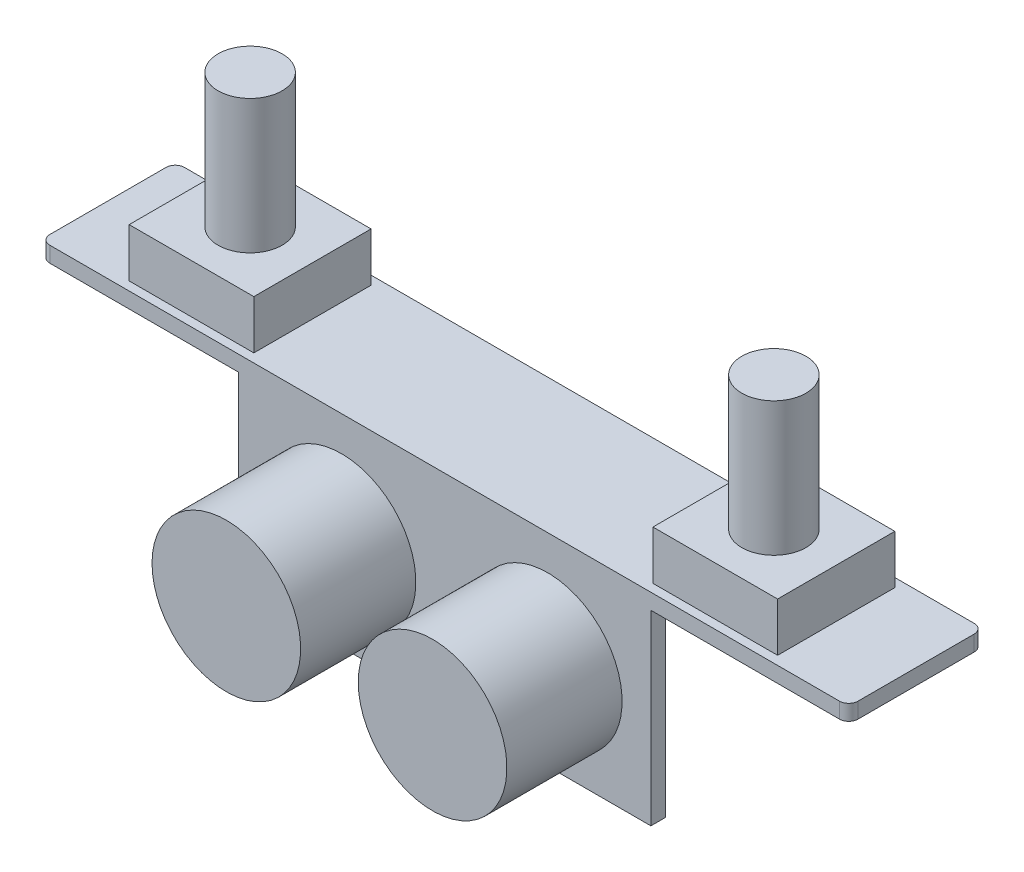
from build123d import *

# Parameters (mm, degrees)
BOSS_EXTRUDE1_DEPTH = 1.68
SKETCH3_W           = 13.42
SKETCH3_H           = 12.62
BOSS_EXTRUDE2_DEPTH = 5.25
SKETCH4_R           = 3.45
BOSS_EXTRUDE3_DEPTH = 14.4
SKETCH5_W           = 44.4
SKETCH5_H           = 20.1
BOSS_EXTRUDE4_DEPTH = 1.6
SKETCH6_R           = 8
BOSS_EXTRUDE5_DEPTH = 12.4


with BuildPart() as part:
    # Sketch1 → Boss-Extrude1 (new body)
    with BuildSketch(Plane(origin=(0, 0, 0), x_dir=(1, 0, 0), z_dir=(0, 1, 0))):
        with BuildLine():
            Line((-42.5, 7.25), (42.5, 7.25))
            ThreePointArc((42.5, 7.25), (43.207106781, 6.957106781), (43.5, 6.25))
            Line((43.5, 6.25), (43.5, -6.25))
            ThreePointArc((43.5, -6.25), (43.207106781, -6.957106781), (42.5, -7.25))
            Line((42.5, -7.25), (-42.5, -7.25))
            ThreePointArc((-42.5, -7.25), (-43.207106781, -6.957106781), (-43.5, -6.25))
            Line((-43.5, -6.25), (-43.5, 6.25))
            ThreePointArc((-43.5, 6.25), (-43.207106781, 6.957106781), (-42.5, 7.25))
        make_face()
    extrude(amount=BOSS_EXTRUDE1_DEPTH)

    # Sketch3 → Boss-Extrude2 (add)
    with BuildSketch(Plane(origin=(0, 1.68, 0), x_dir=(1, 0, 0), z_dir=(0, 1, 0))):
        with Locations((28.19, 0)):
            Rectangle(SKETCH3_W, SKETCH3_H)
        with Locations((-28.19, 0)):
            Rectangle(SKETCH3_W, SKETCH3_H)
    extrude(amount=BOSS_EXTRUDE2_DEPTH)

    # Sketch4 → Boss-Extrude3 (add)
    with BuildSketch(Plane(origin=(0, 6.93, 0), x_dir=(1, 0, 0), z_dir=(0, 1, 0))):
        with Locations(Location((-28.19, 0, 0), (0, 0, 270))):
            Circle(SKETCH4_R)
        with Locations(Location((28.19, 0, 0), (0, 0, 90))):
            Circle(SKETCH4_R)
    extrude(amount=BOSS_EXTRUDE3_DEPTH)

    # Sketch5 → Boss-Extrude4 (add)
    with BuildSketch(Plane.XY.offset(7.25)):
        with Locations((0, -10.05)):
            Rectangle(SKETCH5_W, SKETCH5_H)
    extrude(amount=-BOSS_EXTRUDE4_DEPTH)

    # Sketch6 → Boss-Extrude5 (add)
    with BuildSketch(Plane.XY.offset(7.25)):
        with Locations(Location((11.1, -10.05, 0), (0, 0, 180))):
            Circle(SKETCH6_R)
        with Locations(Location((-11.1, -10.05, 0), (0, 0, 180))):
            Circle(SKETCH6_R)
    extrude(amount=BOSS_EXTRUDE5_DEPTH)


solid = part.part
